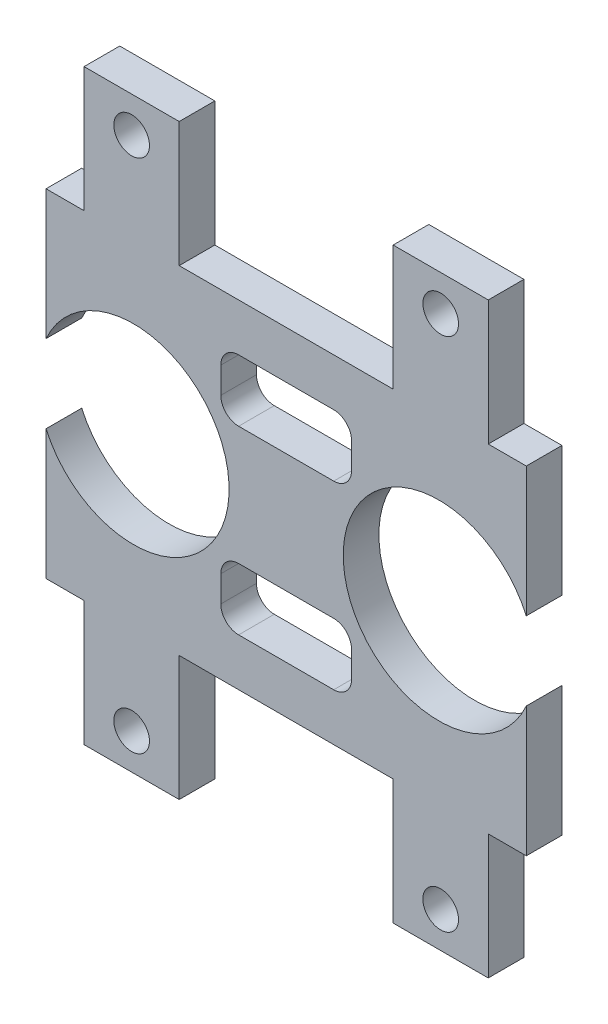
from build123d import *

# Parameters (mm, degrees)
ESBO_O1_W                = 40.4
ESBO_O1_H                = 28.4
RESSALTO_EXTRUS_O1_DEPTH = 3
ESBO_O2_W                = 8
ESBO_O2_H                = 10.5
ESBO_O2_R                = 1.5
RESSALTO_EXTRUS_O2_DEPTH = 3
ESBO_O3_R                = 8.05
ESBO_O3_W                = 11
ESBO_O3_H                = 5.2
CORTE_EXTRUS_O1_DEPTH    = 33.048868935
FILETE1_R                = 1.5
FILETE2_R                = 1.5
FILETE3_R                = 1.5


with BuildPart() as part:
    # Esboço1 → Ressalto-extrusão1 (new body)
    with BuildSketch(Plane.XY):
        Rectangle(ESBO_O1_W, ESBO_O1_H)
    extrude(amount=RESSALTO_EXTRUS_O1_DEPTH)

    # Esboço2 → Ressalto-extrusão2 (add)
    # profile 1 of 4: a face of its own
    with BuildSketch(Plane.XY.offset(3)):
        with Locations((-13, -19.45)):
            Rectangle(ESBO_O2_W, ESBO_O2_H)
        with Locations((-13, -21.7)):
            Circle(ESBO_O2_R, mode=Mode.SUBTRACT)
    # profile 2 of 4: a face of its own
    with BuildSketch(Plane.XY.offset(3)):
        with Locations((13, -19.45)):
            Rectangle(ESBO_O2_W, ESBO_O2_H)
        with Locations((13, -21.7)):
            Circle(ESBO_O2_R, mode=Mode.SUBTRACT)
    # profile 3 of 4: a face of its own
    with BuildSketch(Plane.XY.offset(3)):
        with Locations((13, 19.45)):
            Rectangle(ESBO_O2_W, ESBO_O2_H)
        with Locations((13, 21.7)):
            Circle(ESBO_O2_R, mode=Mode.SUBTRACT)
    # profile 4 of 4: a face of its own
    with BuildSketch(Plane.XY.offset(3)):
        with Locations((-13, 19.45)):
            Rectangle(ESBO_O2_W, ESBO_O2_H)
        with Locations((-13, 21.7)):
            Circle(ESBO_O2_R, mode=Mode.SUBTRACT)
    extrude(amount=-RESSALTO_EXTRUS_O2_DEPTH)

    # Esboço3 → Corte-extrusão1 (cut, through all)
    with BuildSketch(Plane.XY.offset(3)):
        with Locations((-12.85, 0)):
            Circle(ESBO_O3_R)
        with Locations((12.85, 0)):
            Circle(ESBO_O3_R)
        with Locations((0, -7.6)):
            Rectangle(ESBO_O3_W, ESBO_O3_H)
        with Locations((0, 7.6)):
            Rectangle(ESBO_O3_W, ESBO_O3_H)
    extrude(amount=-CORTE_EXTRUS_O1_DEPTH, mode=Mode.SUBTRACT)

    # Filete1
    filete1_edges = [part.edges().sort_by_distance(p)[0] for p in [
        (-5.5, -5, 1.5),
        (5.5, -5, 1.5),
    ]]
    fillet(filete1_edges, radius=FILETE1_R)

    # Filete2
    filete2_edges = [part.edges().sort_by_distance(p)[0] for p in [
        (-5.5, -10.2, 1.5),
        (5.5, -10.2, 1.5),
    ]]
    fillet(filete2_edges, radius=FILETE2_R)

    # Filete3
    filete3_edges = [part.edges().sort_by_distance(p)[0] for p in [
        (5.5, 10.2, 1.5),
        (5.5, 5, 1.5),
        (-5.5, 5, 1.5),
        (-5.5, 10.2, 1.5),
    ]]
    fillet(filete3_edges, radius=FILETE3_R)


solid = part.part
